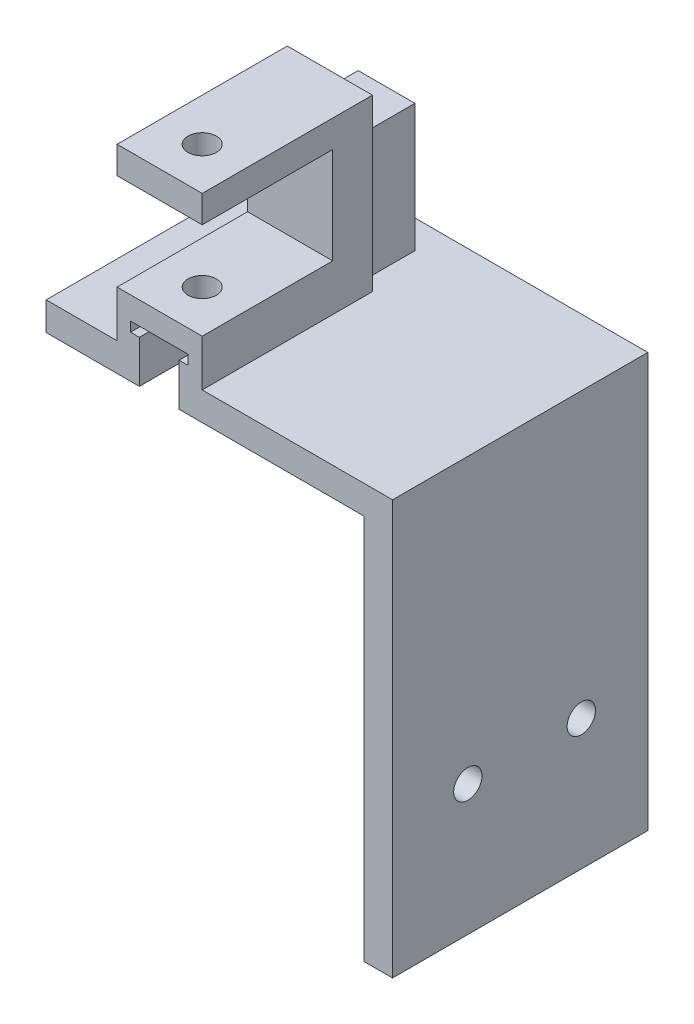
from build123d import *

# Parameters (mm, degrees)
SKETCH1_W           = 61.05
SKETCH1_H           = 45
BOSS_EXTRUDE2_DEPTH = 5
SKETCH2_W           = 10
SKETCH2_H           = 10
BOSS_EXTRUDE3_DEPTH = 22.5
SKETCH3_R           = 4
CUT_EXTRUDE1_DEPTH  = 8
SKETCH6_W           = 15
SKETCH6_H           = 30
BOSS_EXTRUDE4_DEPTH = 30
SKETCH7_W           = 15
SKETCH7_H           = 17
CUT_EXTRUDE3_DEPTH  = 23
SKETCH8_R           = 2.5
CUT_EXTRUDE4_DEPTH  = 84.529051832
SKETCH9_W           = 5
SKETCH9_H           = 45
BOSS_EXTRUDE5_DEPTH = 68
SKETCH10_R          = 2.5
CUT_EXTRUDE5_DEPTH  = 5
CUT_EXTRUDE6_DEPTH  = 16


with BuildPart() as part:
    # Sketch1 → Boss-Extrude2 (new body)
    with BuildSketch(Plane(origin=(0, 0, 0), x_dir=(1, 0, 0), z_dir=(0, 1, 0))):
        with Locations((30.525, 22.5)):
            Rectangle(SKETCH1_W, SKETCH1_H)
    extrude(amount=BOSS_EXTRUDE2_DEPTH)

    # Sketch2 → Boss-Extrude3 (add)
    with BuildSketch(Plane(origin=(0, 5, 0), x_dir=(1, 0, 0), z_dir=(0, 1, 0))):
        with Locations((20, 35)):
            Rectangle(SKETCH2_W, SKETCH2_H)
    extrude(amount=BOSS_EXTRUDE3_DEPTH)

    # Sketch3 → Cut-Extrude1 (cut)
    with BuildSketch(Plane(origin=(0, 0, -40), x_dir=(-1, 0, 0), z_dir=(0, 0, -1))):
        with Locations((-20, 20.9)):
            Circle(SKETCH3_R)
    extrude(amount=-CUT_EXTRUDE1_DEPTH, mode=Mode.SUBTRACT)

    # Sketch6 → Boss-Extrude4 (add)
    with BuildSketch(Plane(origin=(0, 5, 0), x_dir=(1, 0, 0), z_dir=(0, 1, 0))):
        with Locations((20, 15)):
            Rectangle(SKETCH6_W, SKETCH6_H)
    extrude(amount=BOSS_EXTRUDE4_DEPTH)

    # Sketch7 → Cut-Extrude3 (cut)
    with BuildSketch(Plane.XY):
        with Locations((20, 21.7)):
            Rectangle(SKETCH7_W, SKETCH7_H)
    extrude(amount=-CUT_EXTRUDE3_DEPTH, mode=Mode.SUBTRACT)

    # Sketch8 → Cut-Extrude4 (cut, through all)
    with BuildSketch(Plane(origin=(0, 35, 0), x_dir=(1, 0, 0), z_dir=(0, 1, 0))):
        with Locations(Location((20, 7.5, 0), (0, 0, 270))):
            Circle(SKETCH8_R)
    extrude(amount=-CUT_EXTRUDE4_DEPTH, mode=Mode.SUBTRACT)

    # Sketch9 → Boss-Extrude5 (add)
    with BuildSketch(Plane.XZ):
        with Locations((58.55, -22.5)):
            Rectangle(SKETCH9_W, SKETCH9_H)
    extrude(amount=BOSS_EXTRUDE5_DEPTH)

    # Sketch10 → Cut-Extrude5 (cut)
    with BuildSketch(Plane(origin=(61.05, 0, 0), x_dir=(0, 0, -1), z_dir=(1, 0, 0))):
        with Locations((13.274189438, -45)):
            Circle(SKETCH10_R)
        with Locations((33.274189438, -45)):
            Circle(SKETCH10_R)
    extrude(amount=-CUT_EXTRUDE5_DEPTH, mode=Mode.SUBTRACT)

    # Sketch11 → Cut-Extrude6 (cut)
    with BuildSketch(Plane.XY):
        Polygon((24.979172019, 9.2), (14.879172019, 9.2), (14.879172019, 7.5), (16.429172019, 7.5), (16.429172019, -2.944116306), (23.429172019, -2.944116306), (23.429172019, 7.5), (24.979172019, 7.5), align=None)
    extrude(amount=-CUT_EXTRUDE6_DEPTH, mode=Mode.SUBTRACT)


solid = part.part
